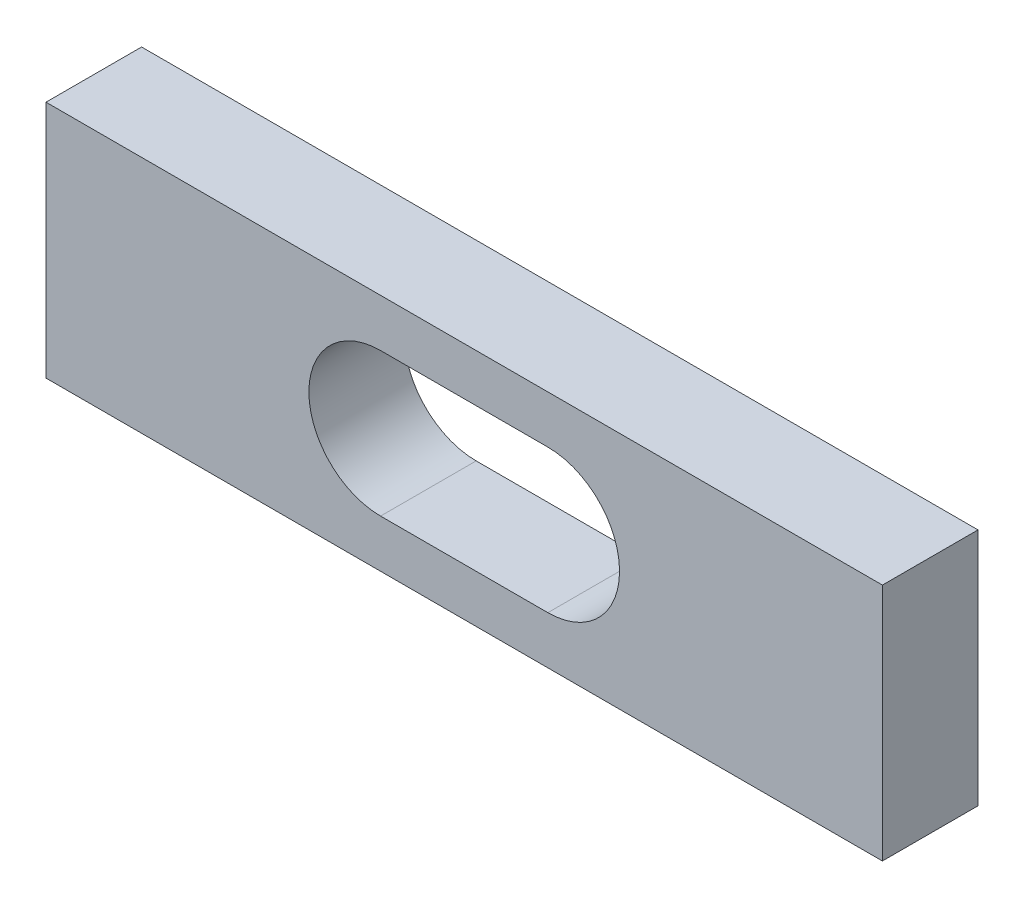
from build123d import *

# Parameters (mm, degrees)
CROQUIS1_W              = 35
CROQUIS1_H              = 10
CROQUIS1_R              = 2.5
SALIENTE_EXTRUIR1_DEPTH = 2
CROQUIS2_W              = 35
CROQUIS2_H              = 10
SALIENTE_EXTRUIR2_DEPTH = 2


with BuildPart() as part:
    # Croquis1 → Saliente-Extruir1 (new body)
    with BuildSketch(Plane.XY):
        with Locations((17.5, 5)):
            Rectangle(CROQUIS1_W, CROQUIS1_H)
        with Locations((29.5, 5)):
            Circle(CROQUIS1_R, mode=Mode.SUBTRACT)
        with Locations((5.5, 5)):
            Circle(CROQUIS1_R, mode=Mode.SUBTRACT)
        with BuildLine():
            Line((14, 8), (21, 8))
            ThreePointArc((21, 8), (24, 5), (21, 2))
            Line((21, 2), (14, 2))
            ThreePointArc((14, 2), (11, 5), (14, 8))
        make_face(mode=Mode.SUBTRACT)
    extrude(amount=SALIENTE_EXTRUIR1_DEPTH)

    # Croquis2 → Saliente-Extruir2 (add)
    with BuildSketch(Plane.XY.offset(2)):
        with Locations((17.5, 5)):
            Rectangle(CROQUIS2_W, CROQUIS2_H)
        with BuildLine():
            Line((14, 8), (21, 8))
            ThreePointArc((21, 8), (24, 5), (21, 2))
            Line((21, 2), (14, 2))
            ThreePointArc((14, 2), (11, 5), (14, 8))
        make_face(mode=Mode.SUBTRACT)
    extrude(amount=SALIENTE_EXTRUIR2_DEPTH)


solid = part.part
